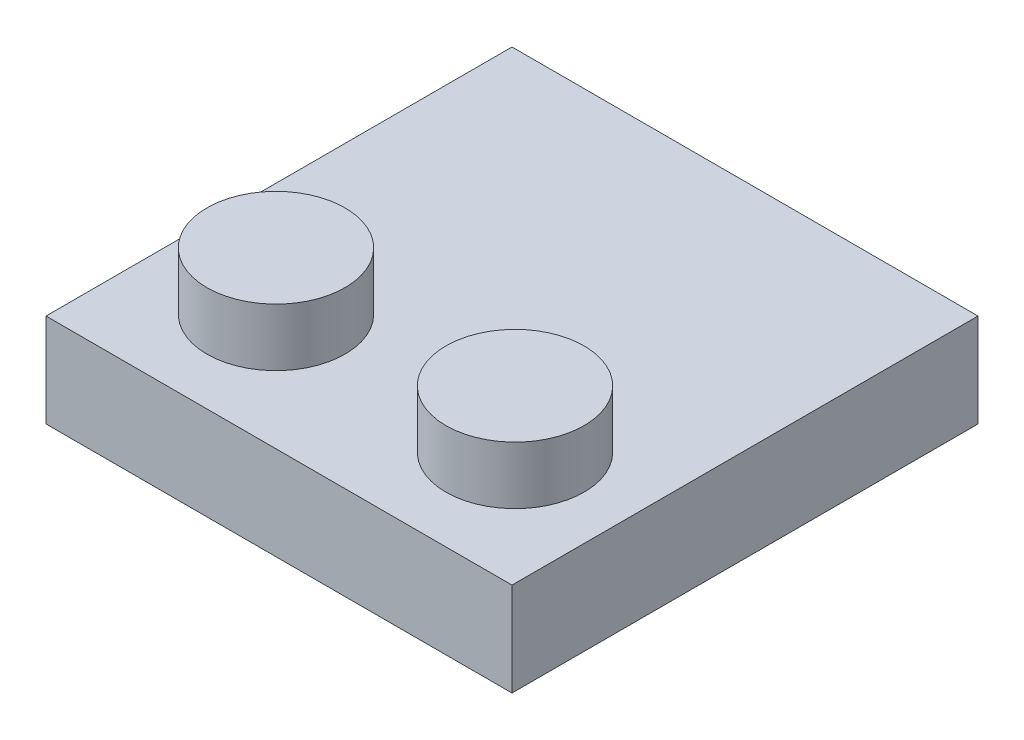
from build123d import *

# Parameters (mm, degrees)
SKETCH1_W           = 15.85
SKETCH1_H           = 15.85
BOSS_EXTRUDE1_DEPTH = 3.18
SKETCH2_R           = 2.35
BOSS_EXTRUDE2_DEPTH = 1.96
SHELL1_T            = -1.38
SKETCH3_R           = 3.1
SKETCH3_R_2         = 2.82
BOSS_EXTRUDE3_DEPTH = 1.48


with BuildPart() as part:
    # Sketch1 → Boss-Extrude1 (new body)
    with BuildSketch(Plane(origin=(0, 0, 0), x_dir=(1, 0, 0), z_dir=(0, 1, 0))):
        Rectangle(SKETCH1_W, SKETCH1_H)
    extrude(amount=-BOSS_EXTRUDE1_DEPTH)

    # Sketch2 → Boss-Extrude2 (add)
    with BuildSketch(Plane(origin=(0, 0, 0), x_dir=(1, 0, 0), z_dir=(0, 1, 0))):
        with Locations(Location((-4.065, -3.9625, 0), (0, 0, 270))):
            Circle(SKETCH2_R)
        with Locations(Location((4.065166585, -3.9625, 0), (0, 0, 270))):
            Circle(SKETCH2_R)
    extrude(amount=BOSS_EXTRUDE2_DEPTH)

    # Shell1
    shell1_openings = [part.faces().sort_by_distance(p)[0] for p in [
        (0, -3.18, 0),
    ]]
    offset(amount=SHELL1_T, openings=shell1_openings, kind=Kind.INTERSECTION)

    # Sketch3 → Boss-Extrude3 (add)
    with BuildSketch(Plane.XZ.offset(1.38)):
        with Locations(Location((0, 0, 0), (0, 0, 90))):
            Circle(SKETCH3_R)
        with Locations(Location((0, 0, 0), (0, 0, 270))):
            Circle(SKETCH3_R_2, mode=Mode.SUBTRACT)
    extrude(amount=BOSS_EXTRUDE3_DEPTH)


solid = part.part
